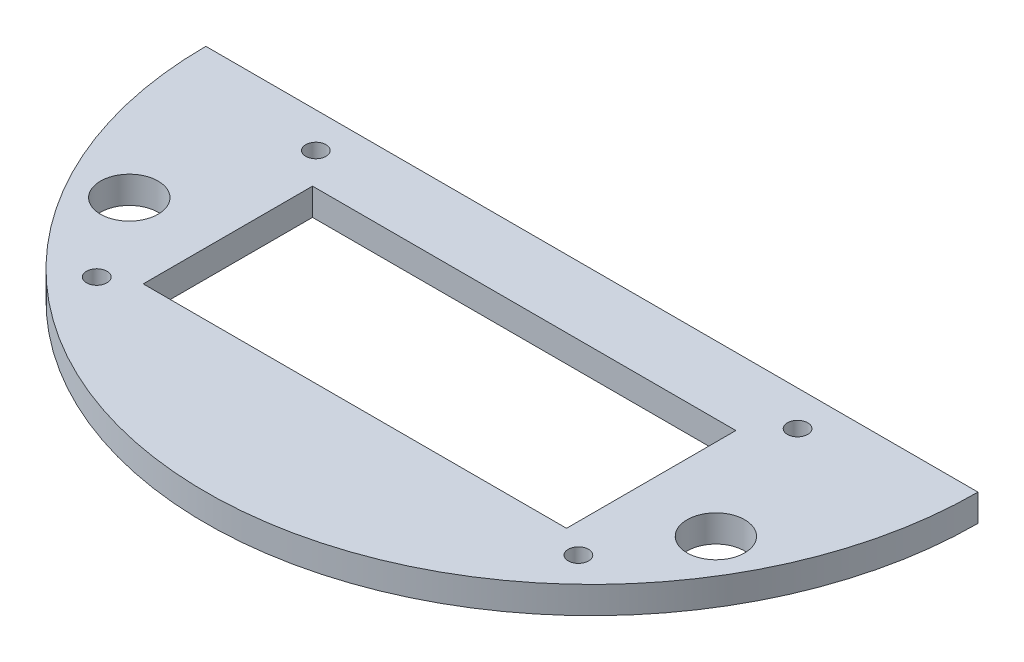
from build123d import *

# Parameters (mm, degrees)
ESQUISSE1_R             = 4.25
ESQUISSE1_W             = 62.5
ESQUISSE1_H             = 25
BOSS_EXTRU_1_DEPTH      = 4
ESQUISSE2_R             = 1.5
ENL_V_MAT_EXTRU_1_DEPTH = 81.709355096


with BuildPart() as part:
    # Esquisse1 → Boss.-Extru.1 (new body)
    with BuildSketch(Plane(origin=(0, 0, 0), x_dir=(1, 0, 0), z_dir=(0, 1, 0))):
        with BuildLine():
            Line((-57, 0), (57, 0))
            ThreePointArc((57, 0), (0, -57), (-57, 0))
        make_face()
        with Locations(Location((-43.301270189, -25, 0), (0, 0, 270))):
            Circle(ESQUISSE1_R, mode=Mode.SUBTRACT)
        with Locations(Location((43.301270189, -25, 0), (0, 0, 270))):
            Circle(ESQUISSE1_R, mode=Mode.SUBTRACT)
        with Locations((0, -22.5)):
            Rectangle(ESQUISSE1_W, ESQUISSE1_H, mode=Mode.SUBTRACT)
    extrude(amount=BOSS_EXTRU_1_DEPTH)

    # Esquisse2 → Enlèv. mat.-Extru.1 (cut, through all)
    with BuildSketch(Plane(origin=(0, 4, 0), x_dir=(1, 0, 0), z_dir=(0, 1, 0))):
        with Locations(Location((-35.557071612, -37.554578926, 0), (0, 0, 270))):
            Circle(ESQUISSE2_R)
        with Locations(Location((-35.557071612, -5.198506408, 0), (0, 0, 270))):
            Circle(ESQUISSE2_R)
        with Locations(Location((35.557071612, -5.198506408, 0), (0, 0, 270))):
            Circle(ESQUISSE2_R)
        with Locations(Location((35.557071612, -37.554578926, 0), (0, 0, 270))):
            Circle(ESQUISSE2_R)
    extrude(amount=-ENL_V_MAT_EXTRU_1_DEPTH, mode=Mode.SUBTRACT)


solid = part.part
